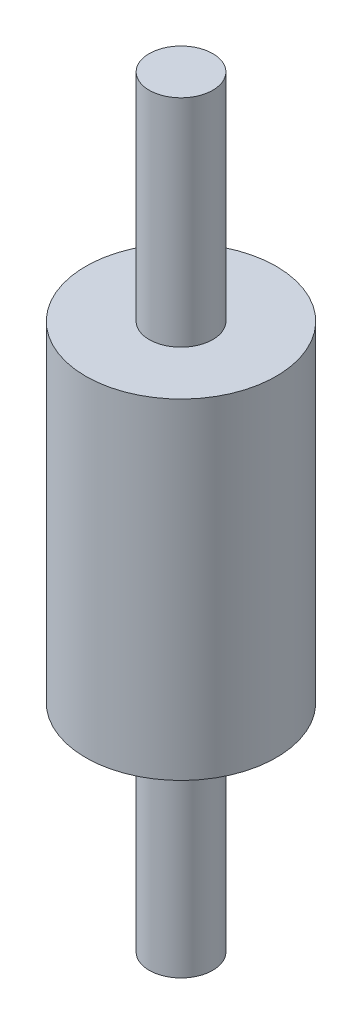
from build123d import *


with BuildPart() as part:
    # Sketch1 → Revolve1 (revolve)
    with BuildSketch(Plane(origin=(0, 0, 0), x_dir=(0, 0, -1), z_dir=(1, 0, 0))):
        Polygon((0, -30), (2.5, -30), (2.5, -13), (7.5, -13), (7.5, 13), (2.5, 13), (2.5, 30), (0, 30), align=None)
    revolve(axis=Axis((0, 0, 0), (0, 1, 0)))


solid = part.part
